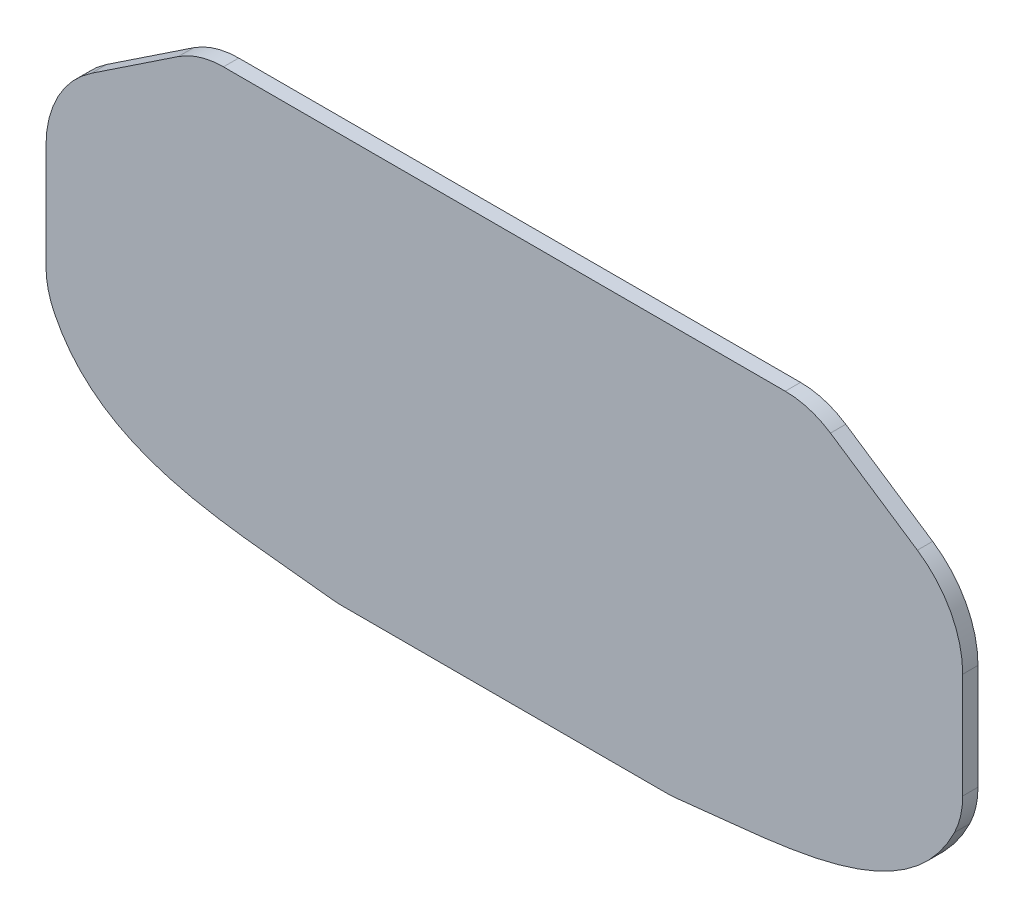
from build123d import *

# Parameters (mm, degrees)
BOSS_EXTRUDE1_DEPTH = 3.81
FILLET1_R           = 20.32
FILLET3_R           = 25.4
CUT_EXTRUDE8_DEPTH  = 251.19
FILLET4_R           = 20.32
FILLET5_R           = 20.32


with BuildPart() as part:
    # Sketch1 → Boss-Extrude1 (new body)
    with BuildSketch(Plane.XY):
        Polygon((0, 76.2), (38.1, 101.6), (190.5, 101.6), (228.6, 76.2), (228.6, 0), (0, 0), align=None)
    extrude(amount=BOSS_EXTRUDE1_DEPTH)

    # Fillet1
    fillet1_edges = [part.edges().sort_by_distance(p)[0] for p in [
        (190.5, 101.6, 1.905),
        (38.1, 101.6, 1.905),
    ]]
    fillet(fillet1_edges, radius=FILLET1_R)

    # Fillet3
    fillet3_edges = [part.edges().sort_by_distance(p)[0] for p in [
        (0, 76.2, 1.905),
        (228.6, 76.2, 1.905),
    ]]
    fillet(fillet3_edges, radius=FILLET3_R)

    # Sketch2 → Cut-Extrude8 (cut, through all)
    with BuildSketch(Plane.XY.offset(3.81)):
        with BuildLine():
            Line((72.324780666, 0), (0, 0))
            Line((0, 0), (0, 32.483690967))
            add(Edge.make_bspline(
                [(0, 32.483690967), (10.059478489, 1.840398762), (47.836090043, 3.417036799), (72.324780666, 0)],
                knots=[0, 0, 0, 0, 1, 1, 1, 1], degree=3))
        make_face()
        with BuildLine():
            Line((156.275219334, 0), (228.6, 0))
            Line((228.6, 0), (228.6, 32.483690967))
            add(Edge.make_bspline(
                [(228.6, 32.483690967), (218.540521511, 1.840398762), (180.763909957, 3.417036799), (156.275219334, 0)],
                knots=[0, 0, 0, 0, 1, 1, 1, 1], degree=3))
        make_face()
    extrude(amount=-CUT_EXTRUDE8_DEPTH, mode=Mode.SUBTRACT)

    # Fillet4
    fillet4_edges = [part.edges().sort_by_distance(p)[0] for p in [
        (0, 32.483690967, 1.905),
        (228.6, 32.483690967, 1.905),
    ]]
    fillet(fillet4_edges, radius=FILLET4_R)

    # Fillet5
    fillet5_edges = [part.edges().sort_by_distance(p)[0] for p in [
        (72.324780666, 0, 1.905),
        (156.275219334, 0, 1.905),
    ]]
    fillet(fillet5_edges, radius=FILLET5_R)


solid = part.part
